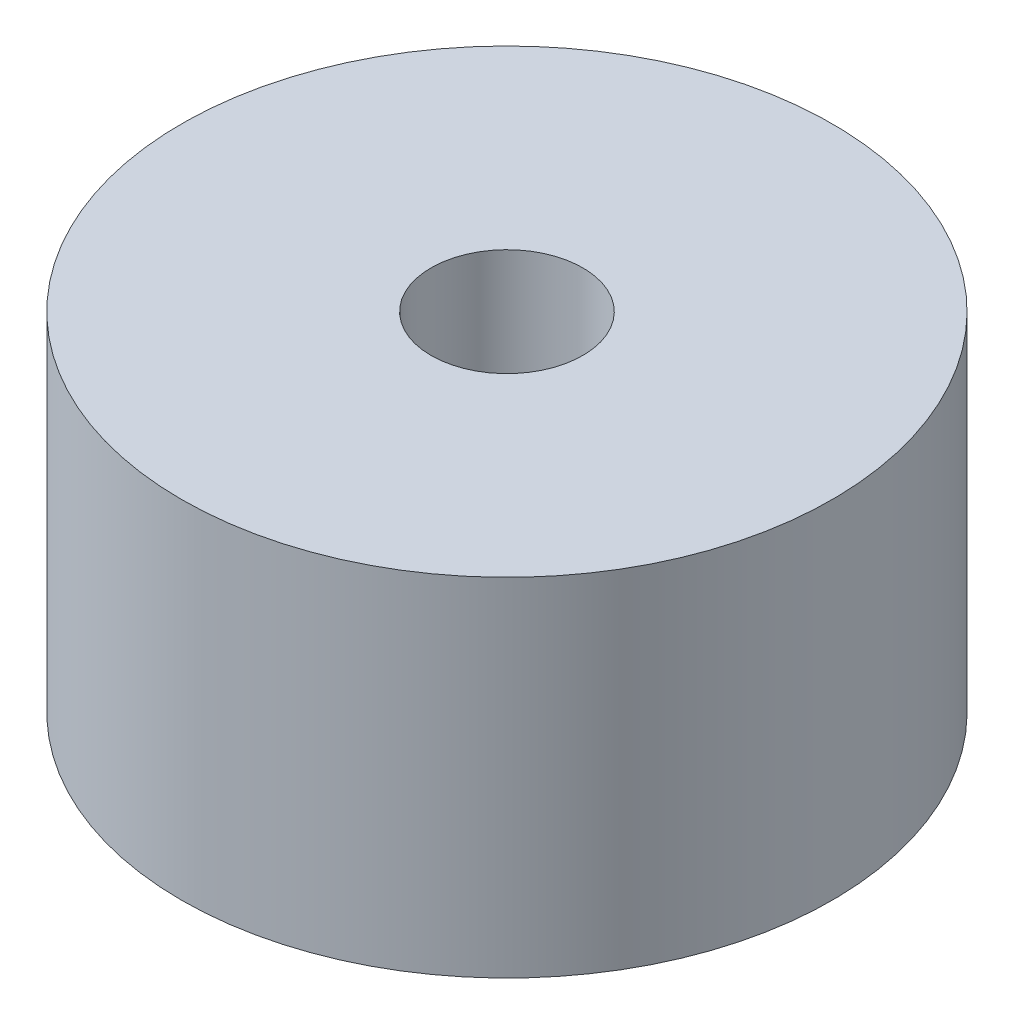
from build123d import *

# Parameters (mm, degrees)
SKETCH1_R           = 7.5
SKETCH1_R_2         = 1.75
BOSS_EXTRUDE1_DEPTH = 8


with BuildPart() as part:
    # Sketch1 → Boss-Extrude1 (new body)
    with BuildSketch(Plane(origin=(0, 0, 0), x_dir=(1, 0, 0), z_dir=(0, 1, 0))):
        with Locations(Location((0, 0, 0), (0, 0, 270))):
            Circle(SKETCH1_R)
        with Locations(Location((0, 0, 0), (0, 0, 270))):
            Circle(SKETCH1_R_2, mode=Mode.SUBTRACT)
    extrude(amount=BOSS_EXTRUDE1_DEPTH)


solid = part.part
